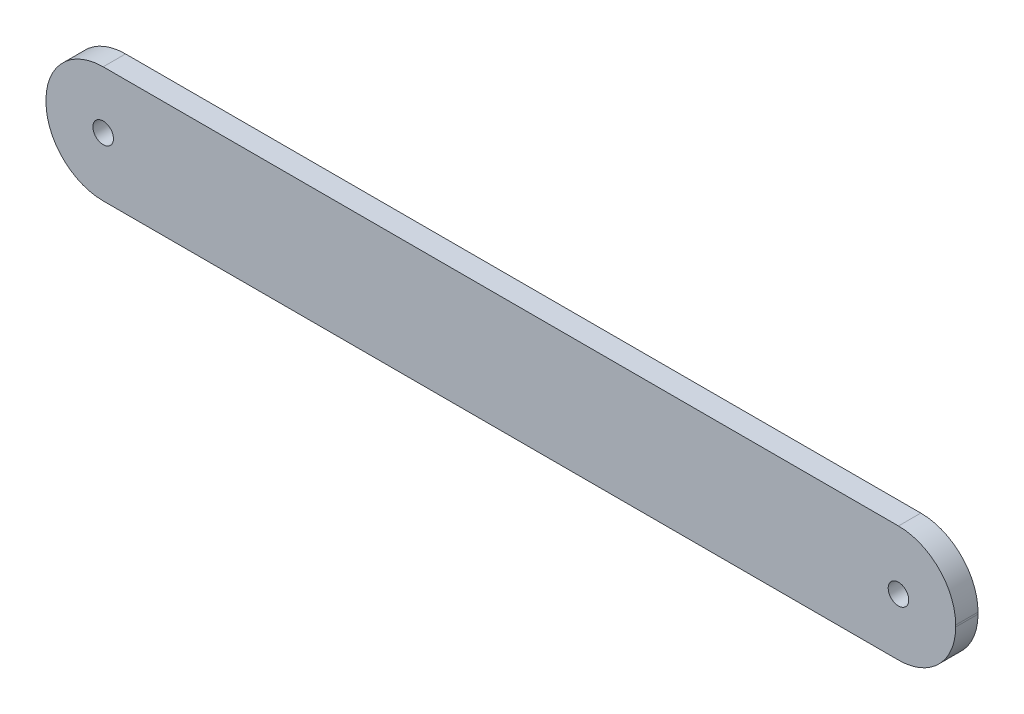
from build123d import *

# Parameters (mm, degrees)
SKETCH1_W           = 129.286
SKETCH1_H           = 16.51
BOSS_EXTRUDE1_DEPTH = 3.175
FILLET1_R           = 8.128
SKETCH2_R           = 1.4605
CUT_EXTRUDE1_DEPTH  = 66.24525346


with BuildPart() as part:
    # Sketch1 → Boss-Extrude1 (new body)
    with BuildSketch(Plane.XY):
        Rectangle(SKETCH1_W, SKETCH1_H)
    extrude(amount=BOSS_EXTRUDE1_DEPTH)

    # Fillet1
    fillet1_edges = [part.edges().sort_by_distance(p)[0] for p in [
        (64.643, -8.255, 1.5875),
        (-64.643, -8.255, 1.5875),
        (-64.643, 8.255, 1.5875),
        (64.643, 8.255, 1.5875),
    ]]
    fillet(fillet1_edges, radius=FILLET1_R)

    # Sketch2 → Cut-Extrude1 (cut, through all)
    with BuildSketch(Plane.XY.offset(3.175)):
        with Locations((-56.515, 0.127)):
            Circle(SKETCH2_R)
        with Locations((56.515, -0.127)):
            Circle(SKETCH2_R)
    extrude(amount=-CUT_EXTRUDE1_DEPTH, mode=Mode.SUBTRACT)


solid = part.part
